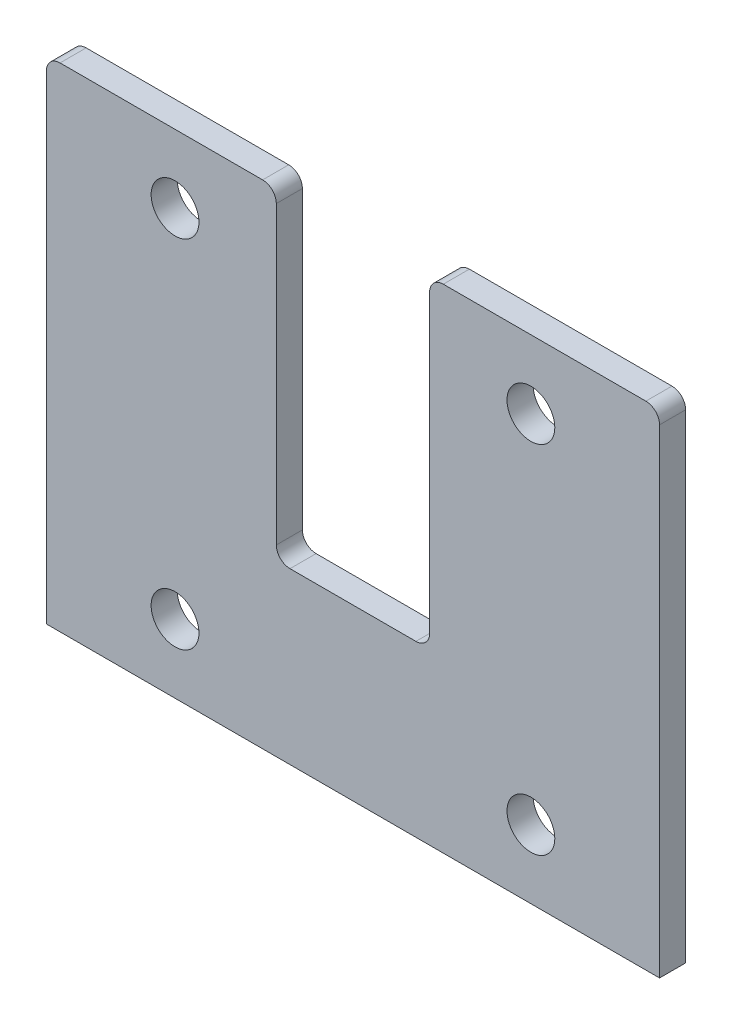
from build123d import *

# Parameters (mm, degrees)
CROQUIS1_W              = 224
CROQUIS1_H              = 180
SALIENTE_EXTRUIR1_DEPTH = 9.525
CORTAR_EXTRUIR1_DEPTH   = 12.7
REDONDEO1_R             = 5
CROQUIS3_R              = 8.73125
CORTAR_EXTRUIR2_DEPTH   = 13


with BuildPart() as part:
    # Croquis1 → Saliente-Extruir1 (new body)
    with BuildSketch(Plane.XY):
        with Locations((112, -90)):
            Rectangle(CROQUIS1_W, CROQUIS1_H)
    extrude(amount=SALIENTE_EXTRUIR1_DEPTH)

    # Croquis2 → Cortar-Extruir1 (cut)
    with BuildSketch(Plane.XY.offset(9.525)):
        Polygon((84, 0), (84, -118), (140, -118), (140, 0), (112, 0), align=None)
    extrude(amount=-CORTAR_EXTRUIR1_DEPTH, mode=Mode.SUBTRACT)

    # Redondeo1
    redondeo1_edges = [part.edges().sort_by_distance(p)[0] for p in [
        (84, 0, 4.7625),
        (140, 0, 4.7625),
        (140, -118, 4.7625),
        (84, -118, 4.7625),
        (0, 0, 4.7625),
        (224, 0, 4.7625),
    ]]
    fillet(redondeo1_edges, radius=REDONDEO1_R)

    # Croquis3 → Cortar-Extruir2 (cut)
    with BuildSketch(Plane.XY.offset(9.525)):
        with Locations((177, -25)):
            Circle(CROQUIS3_R)
        with Locations((47, -25)):
            Circle(CROQUIS3_R)
        with Locations((47, -155)):
            Circle(CROQUIS3_R)
        with Locations((177, -155)):
            Circle(CROQUIS3_R)
    extrude(amount=-CORTAR_EXTRUIR2_DEPTH, mode=Mode.SUBTRACT)


solid = part.part
